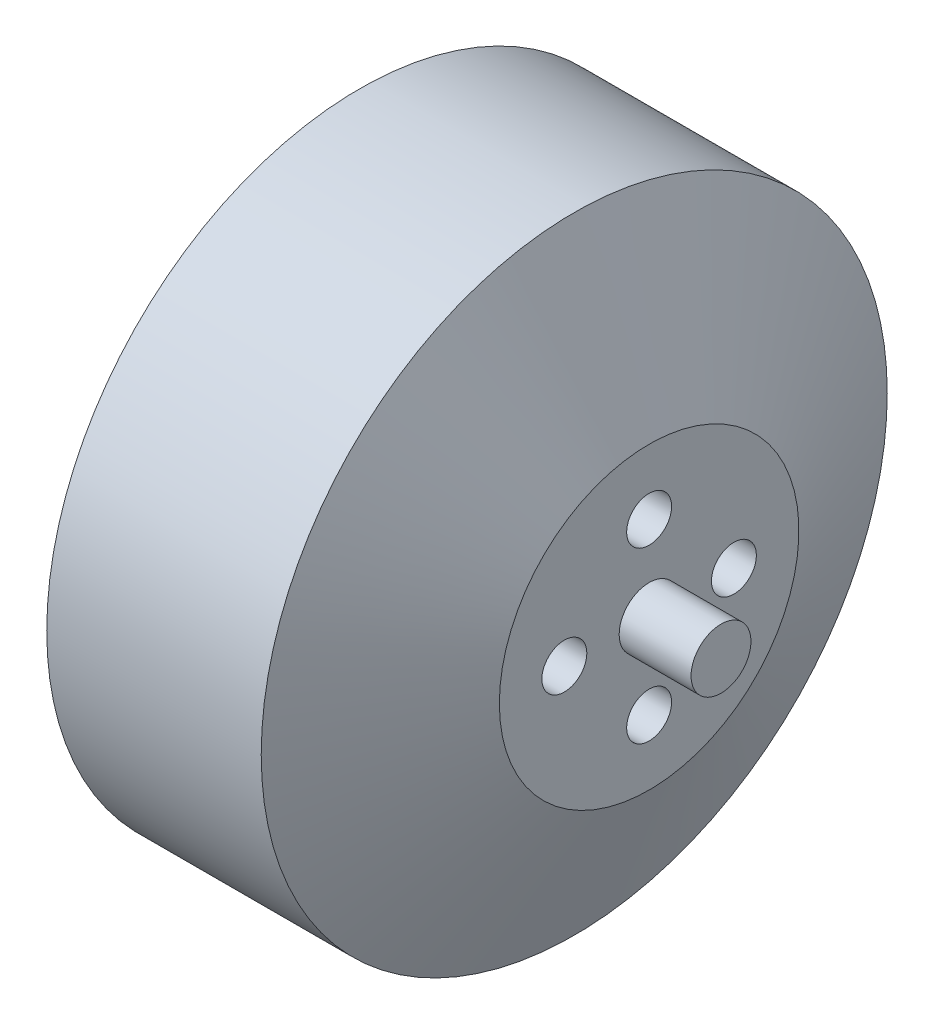
from build123d import *

# Parameters (mm, degrees)
ESQUISSE2_R             = 1.5
ENL_V_MAT_EXTRU_1_DEPTH = 7.5
ESQUISSE3_R             = 19.4
ENL_V_MAT_EXTRU_2_DEPTH = 14.5


with BuildPart() as part:
    # Esquisse1 → Révolution1 (revolve)
    with BuildSketch(Plane.XY, mode=Mode.PRIVATE) as r_volution1_sk:
        Polygon((0, 20.9), (14.32, 20.9), (19.32, 10), (19.32, 2), (24.12, 2), (24.12, 0), (0, 0), align=None)
    revolve(r_volution1_sk.sketch.rotate(Axis((0, 0, 0), (1, 0, 0)), 90), axis=Axis((0, 0, 0), (1, 0, 0)))

    # Esquisse2 → Enlèv. mat.-Extru.1 (cut)
    with BuildSketch(Plane(origin=(19.32, 0, 0), x_dir=(0, 0, -1), z_dir=(1, 0, 0))):
        with Locations(Location((0, -5.66, 0), (0, 0, 180))):
            Circle(ESQUISSE2_R)
        with Locations((-5.66, 0)):
            Circle(ESQUISSE2_R)
        with Locations(Location((0, 5.66, 0), (0, 0, 180))):
            Circle(ESQUISSE2_R)
        with Locations((5.66, 0)):
            Circle(ESQUISSE2_R)
    extrude(amount=-ENL_V_MAT_EXTRU_1_DEPTH, mode=Mode.SUBTRACT)

    # Esquisse3 → Enlèv. mat.-Extru.2 (cut)
    with BuildSketch(Plane.ZY):
        Circle(ESQUISSE3_R)
    extrude(amount=-ENL_V_MAT_EXTRU_2_DEPTH, mode=Mode.SUBTRACT)


solid = part.part
